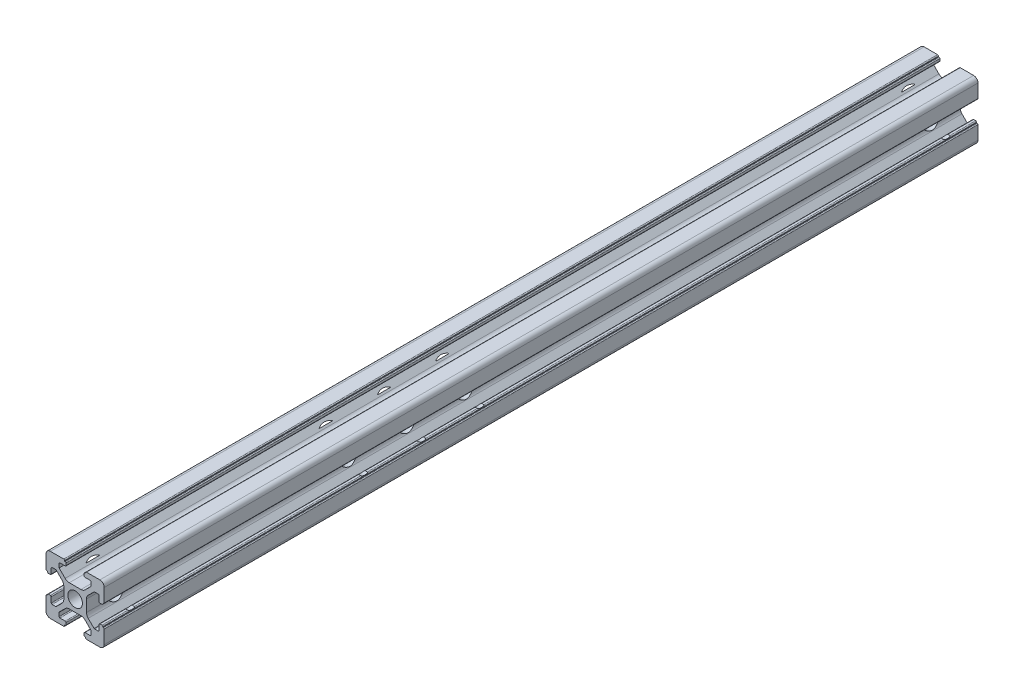
from build123d import *

# Parameters (mm, degrees)
SKETCH_1_R          = 2.5
MEMBER_2020_1_DEPTH = 300
SKETCH2_R           = 3.3
CUT_EXTRUDE1_DEPTH  = 152.657508881
SKETCH3_R           = 5.5
CUT_EXTRUDE2_DEPTH  = 6.1


with BuildPart() as part:
    # 草图1 → Member 2020_1 (new body)
    with BuildSketch(Plane.YX.offset(-150)):
        with BuildLine():
            Line((3.9, 0), (3.9, -2.010912703))
            ThreePointArc((3.9, -2.010912703), (4.052240935, -2.776279568), (4.485786438, -3.425126266))
            Line((4.485786438, -3.425126266), (6.560660172, -5.5))
            Line((6.560660172, -5.5), (7.9, -5.5))
            ThreePointArc((7.9, -5.5), (8.112132034, -5.412132034), (8.2, -5.2))
            Line((8.2, -5.2), (8.2, -3.4))
            ThreePointArc((8.2, -3.4), (8.287867966, -3.187867966), (8.5, -3.1))
            Line((8.5, -3.1), (9.2, -3.1))
            ThreePointArc((9.2, -3.1), (9.412132034, -3.187867966), (9.5, -3.4))
            Line((9.5, -3.4), (9.5, -3.6))
            Line((9.5, -3.6), (9.7, -3.6))
            ThreePointArc((9.7, -3.6), (9.912132034, -3.687867966), (10, -3.9))
            Line((10, -3.9), (10, -8.5))
            ThreePointArc((10, -8.5), (9.560660172, -9.560660172), (8.5, -10))
            Line((8.5, -10), (3.9, -10))
            ThreePointArc((3.9, -10), (3.687867966, -9.912132034), (3.6, -9.7))
            ThreePointArc((3.6, -9.7), (3.541421356, -9.558578644), (3.4, -9.5))
            ThreePointArc((3.4, -9.5), (3.187867966, -9.412132034), (3.1, -9.2))
            Line((3.1, -9.2), (3.1, -8.5))
            ThreePointArc((3.1, -8.5), (3.187867966, -8.287867966), (3.4, -8.2))
            Line((3.4, -8.2), (5.2, -8.2))
            ThreePointArc((5.2, -8.2), (5.412132034, -8.112132034), (5.5, -7.9))
            Line((5.5, -7.9), (5.5, -6.68492424))
            ThreePointArc((5.5, -6.68492424), (5.47716386, -6.570119211), (5.412132034, -6.472792206))
            Line((5.412132034, -6.472792206), (3.425126266, -4.485786438))
            ThreePointArc((3.425126266, -4.485786438), (2.776279568, -4.052240935), (2.010912703, -3.9))
            Line((2.010912703, -3.9), (0, -3.9))
            Line((0, -3.9), (-2.010912703, -3.9))
            ThreePointArc((-2.010912703, -3.9), (-2.776279568, -4.052240935), (-3.425126266, -4.485786438))
            Line((-3.425126266, -4.485786438), (-5.412132034, -6.472792206))
            ThreePointArc((-5.412132034, -6.472792206), (-5.47716386, -6.570119211), (-5.5, -6.68492424))
            Line((-5.5, -6.68492424), (-5.5, -7.9))
            ThreePointArc((-5.5, -7.9), (-5.412132034, -8.112132034), (-5.2, -8.2))
            Line((-5.2, -8.2), (-3.4, -8.2))
            ThreePointArc((-3.4, -8.2), (-3.187867966, -8.287867966), (-3.1, -8.5))
            Line((-3.1, -8.5), (-3.1, -9.2))
            ThreePointArc((-3.1, -9.2), (-3.187867966, -9.412132034), (-3.4, -9.5))
            ThreePointArc((-3.4, -9.5), (-3.541421356, -9.558578644), (-3.6, -9.7))
            ThreePointArc((-3.6, -9.7), (-3.687867966, -9.912132034), (-3.9, -10))
            Line((-3.9, -10), (-8.5, -10))
            ThreePointArc((-8.5, -10), (-9.560660172, -9.560660172), (-10, -8.5))
            Line((-10, -8.5), (-10, -3.9))
            ThreePointArc((-10, -3.9), (-9.912132034, -3.687867966), (-9.7, -3.6))
            Line((-9.7, -3.6), (-9.5, -3.6))
            Line((-9.5, -3.6), (-9.5, -3.4))
            ThreePointArc((-9.5, -3.4), (-9.412132034, -3.187867966), (-9.2, -3.1))
            Line((-9.2, -3.1), (-8.5, -3.1))
            ThreePointArc((-8.5, -3.1), (-8.287867965, -3.187867966), (-8.2, -3.4))
            Line((-8.2, -3.4), (-8.2, -5.2))
            ThreePointArc((-8.2, -5.2), (-8.112132034, -5.412132034), (-7.9, -5.5))
            Line((-7.9, -5.5), (-6.68492424, -5.5))
            ThreePointArc((-6.68492424, -5.5), (-6.570119211, -5.47716386), (-6.472792206, -5.412132034))
            Line((-6.472792206, -5.412132034), (-4.485786438, -3.425126266))
            ThreePointArc((-4.485786438, -3.425126266), (-4.052240935, -2.776279568), (-3.9, -2.010912703))
            Line((-3.9, -2.010912703), (-3.9, 0))
            Line((-3.9, 0), (-3.9, 2.010912703))
            ThreePointArc((-3.9, 2.010912703), (-4.052240935, 2.776279568), (-4.485786438, 3.425126266))
            Line((-4.485786438, 3.425126266), (-6.472792206, 5.412132034))
            ThreePointArc((-6.472792206, 5.412132034), (-6.570119211, 5.47716386), (-6.68492424, 5.5))
            Line((-6.68492424, 5.5), (-7.9, 5.5))
            ThreePointArc((-7.9, 5.5), (-8.112132034, 5.412132034), (-8.2, 5.2))
            Line((-8.2, 5.2), (-8.2, 3.4))
            ThreePointArc((-8.2, 3.4), (-8.287867965, 3.187867966), (-8.5, 3.1))
            Line((-8.5, 3.1), (-9.2, 3.1))
            ThreePointArc((-9.2, 3.1), (-9.412132034, 3.187867966), (-9.5, 3.4))
            Line((-9.5, 3.4), (-9.5, 3.6))
            Line((-9.5, 3.6), (-9.7, 3.6))
            ThreePointArc((-9.7, 3.6), (-9.912132034, 3.687867966), (-10, 3.9))
            Line((-10, 3.9), (-10, 8.5))
            ThreePointArc((-10, 8.5), (-9.560660172, 9.560660172), (-8.5, 10))
            Line((-8.5, 10), (-3.9, 10))
            ThreePointArc((-3.9, 10), (-3.687867966, 9.912132034), (-3.6, 9.7))
            Line((-3.6, 9.7), (-3.6, 9.5))
            Line((-3.6, 9.5), (-3.4, 9.5))
            ThreePointArc((-3.4, 9.5), (-3.187867966, 9.412132034), (-3.1, 9.2))
            Line((-3.1, 9.2), (-3.1, 8.5))
            ThreePointArc((-3.1, 8.5), (-3.187867966, 8.287867966), (-3.4, 8.2))
            Line((-3.4, 8.2), (-5.2, 8.2))
            ThreePointArc((-5.2, 8.2), (-5.412132034, 8.112132034), (-5.5, 7.9))
            Line((-5.5, 7.9), (-5.5, 6.68492424))
            ThreePointArc((-5.5, 6.68492424), (-5.47716386, 6.570119211), (-5.412132034, 6.472792206))
            Line((-5.412132034, 6.472792206), (-3.425126266, 4.485786438))
            ThreePointArc((-3.425126266, 4.485786438), (-2.776279568, 4.052240935), (-2.010912703, 3.9))
            Line((-2.010912703, 3.9), (0, 3.9))
            Line((0, 3.9), (2.010912703, 3.9))
            ThreePointArc((2.010912703, 3.9), (2.776279568, 4.052240935), (3.425126266, 4.485786438))
            Line((3.425126266, 4.485786438), (5.412132034, 6.472792206))
            ThreePointArc((5.412132034, 6.472792206), (5.47716386, 6.570119211), (5.5, 6.68492424))
            Line((5.5, 6.68492424), (5.5, 7.9))
            ThreePointArc((5.5, 7.9), (5.412132034, 8.112132034), (5.2, 8.2))
            Line((5.2, 8.2), (3.4, 8.2))
            ThreePointArc((3.4, 8.2), (3.187867966, 8.287867966), (3.1, 8.5))
            Line((3.1, 8.5), (3.1, 9.2))
            ThreePointArc((3.1, 9.2), (3.187867966, 9.412132034), (3.4, 9.5))
            Line((3.4, 9.5), (3.6, 9.5))
            Line((3.6, 9.5), (3.6, 9.7))
            ThreePointArc((3.6, 9.7), (3.687867966, 9.912132034), (3.9, 10))
            Line((3.9, 10), (8.5, 10))
            ThreePointArc((8.5, 10), (9.560660172, 9.560660172), (10, 8.5))
            Line((10, 8.5), (10, 3.9))
            ThreePointArc((10, 3.9), (9.912132034, 3.687867966), (9.7, 3.6))
            Line((9.7, 3.6), (9.5, 3.6))
            Line((9.5, 3.6), (9.5, 3.4))
            ThreePointArc((9.5, 3.4), (9.412132034, 3.187867966), (9.2, 3.1))
            Line((9.2, 3.1), (8.5, 3.1))
            ThreePointArc((8.5, 3.1), (8.287867966, 3.187867966), (8.2, 3.4))
            Line((8.2, 3.4), (8.2, 5.2))
            ThreePointArc((8.2, 5.2), (8.112132034, 5.412132034), (7.9, 5.5))
            Line((7.9, 5.5), (6.68492424, 5.5))
            ThreePointArc((6.68492424, 5.5), (6.570119211, 5.47716386), (6.472792206, 5.412132034))
            Line((6.472792206, 5.412132034), (4.485786438, 3.425126266))
            ThreePointArc((4.485786438, 3.425126266), (4.052240935, 2.776279568), (3.9, 2.010912703))
            Line((3.9, 2.010912703), (3.9, 0))
        make_face()
        Circle(SKETCH_1_R, mode=Mode.SUBTRACT)
    extrude(amount=MEMBER_2020_1_DEPTH)

    # Sketch2 → Cut-Extrude1 (cut, through all)
    with BuildSketch(Plane.ZY.offset(10)):
        with Locations(Location((40, 0, 0), (0, 0, 217.543782111))):
            Circle(SKETCH2_R)
        with Locations(Location((20, 0, 0), (0, 0, 217.543782111))):
            Circle(SKETCH2_R)
        with Locations(Location((60, 0, 0), (0, 0, 217.543782111))):
            Circle(SKETCH2_R)
        with Locations(Location((-140, 0, 0), (0, 0, 217.543782111))):
            Circle(SKETCH2_R)
        with Locations(Location((140, 0, 0), (0, 0, 217.543782111))):
            Circle(SKETCH2_R)
    extrude(amount=-CUT_EXTRUDE1_DEPTH, mode=Mode.SUBTRACT)

    # Sketch3 → Cut-Extrude2 (cut)
    with BuildSketch(Plane.ZY.offset(10)):
        with Locations((20, 0)):
            Circle(SKETCH3_R)
        with Locations((40, 0)):
            Circle(SKETCH3_R)
        with Locations((60, 0)):
            Circle(SKETCH3_R)
        with Locations((-140, 0)):
            Circle(SKETCH3_R)
        with Locations((140, 0)):
            Circle(SKETCH3_R)
    extrude(amount=-CUT_EXTRUDE2_DEPTH, mode=Mode.SUBTRACT)


solid = part.part
